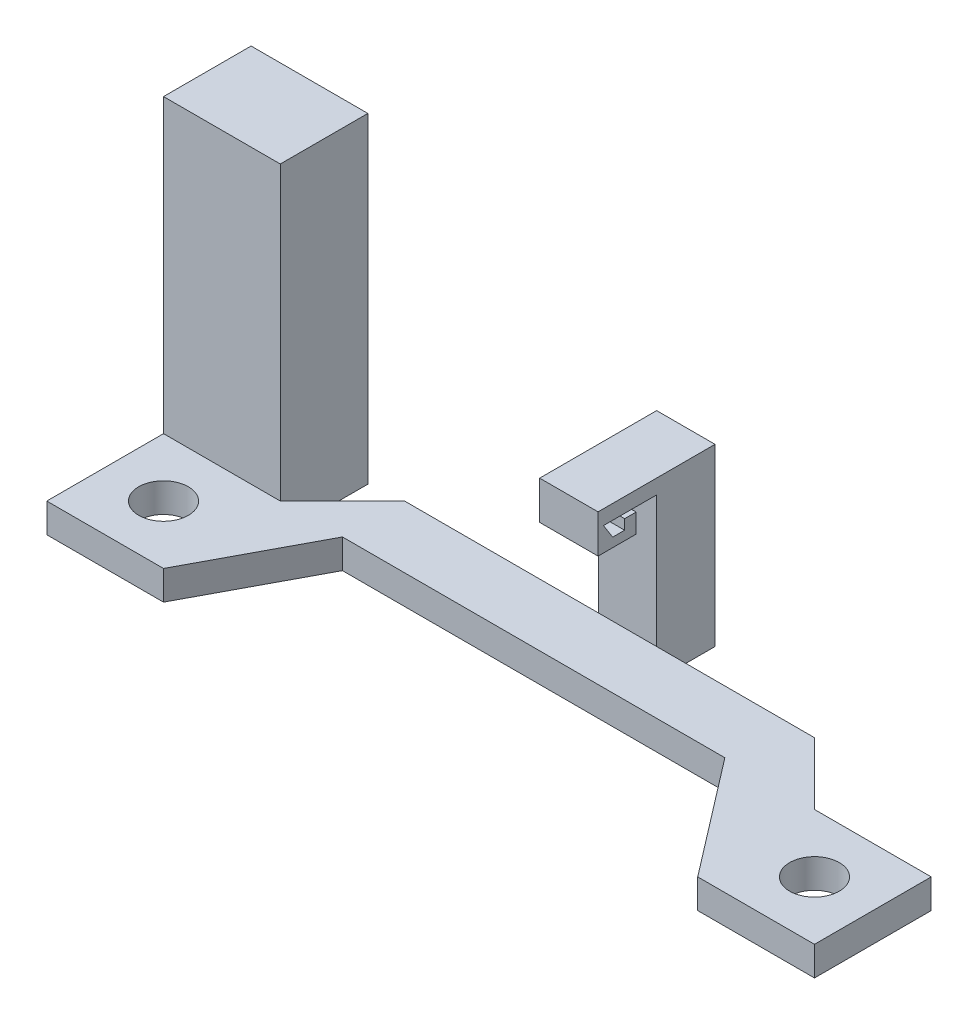
from build123d import *

# Parameters (mm, degrees)
SKETCH1_R                = 2.159
BOSS_EXTRUDE2_DEPTH      = 2.54
BOSS_EXTRUDE5_DEPTH      = 25.4
BOSS_EXTRUDE5_DEPTH_BACK = 2.54
BOSS_EXTRUDE8_DEPTH      = 12.7
BOSS_EXTRUDE8_DEPTH_BACK = 2.54
SKETCH4_W                = 5.08
SKETCH4_H                = 5.08
BOSS_EXTRUDE9_DEPTH      = 5.08


with BuildPart() as part:
    # Sketch1 → Boss-Extrude2 (new body)
    with BuildSketch(Plane(origin=(0, 0, 0), x_dir=(1, 0, 0), z_dir=(0, 1, 0))):
        Polygon((0, -5.08), (5.08, -5.08), (10.489221848, 5.08), (43.764184298, 5.08), (51.562, -5.08), (61.722, -5.08), (61.722, 5.08), (56.642, 5.08), (51.562, 5.08), (46.152778152, 10.489221848), (10.489221848, 10.489221848), (5.08, 5.08), (-5.08, 5.08), (-5.08, -5.08), align=None)
        Circle(SKETCH1_R, mode=Mode.SUBTRACT)
        with Locations((56.642, 0)):
            Circle(SKETCH1_R, mode=Mode.SUBTRACT)
    extrude(amount=BOSS_EXTRUDE2_DEPTH)

    # Sketch3 → Boss-Extrude5 (add, two sides: drawn at the far end of the back side and taken through both)
    with BuildSketch(Plane(origin=(0, 2.54, 0), x_dir=(1, 0, 0), z_dir=(0, 1, 0)).offset(-BOSS_EXTRUDE5_DEPTH_BACK)):
        Polygon((-5.08, 5.08), (5.08, 5.08), (5.08, 12.7), (0, 12.7), (-5.08, 12.7), align=None)
    extrude(amount=BOSS_EXTRUDE5_DEPTH + BOSS_EXTRUDE5_DEPTH_BACK)

    # Sketch4 → Boss-Extrude8 (add, two sides: drawn at the far end of the back side and taken through both)
    with BuildSketch(Plane(origin=(0, 2.54, 0), x_dir=(1, 0, 0), z_dir=(0, 1, 0)).offset(-BOSS_EXTRUDE8_DEPTH_BACK)):
        with Locations((29.878652905, 13.029221848)):
            Rectangle(SKETCH4_W, SKETCH4_H)
    extrude(amount=BOSS_EXTRUDE8_DEPTH + BOSS_EXTRUDE8_DEPTH_BACK)

    # Sketch7 → Boss-Extrude9 (add)
    with BuildSketch(Plane(origin=(32.418652905, 0, 0), x_dir=(0, 0, -1), z_dir=(1, 0, 0))):
        Polygon((10.489221848, 15.24), (5.391589044, 15.24), (5.391589044, 12.7), (5.391589044, 11.903510412), (7.271896049, 11.903510412), (8.703373283, 11.903510412), (8.703373283, 13.570272135), (7.703807283, 13.570272135), (7.703807283, 12.7), (7.271896049, 12.7), (6.661589044, 12.7), (5.865099456, 13.97), (6.661589044, 13.97), (10.489221848, 13.97), align=None)
    extrude(amount=-BOSS_EXTRUDE9_DEPTH)


solid = part.part
